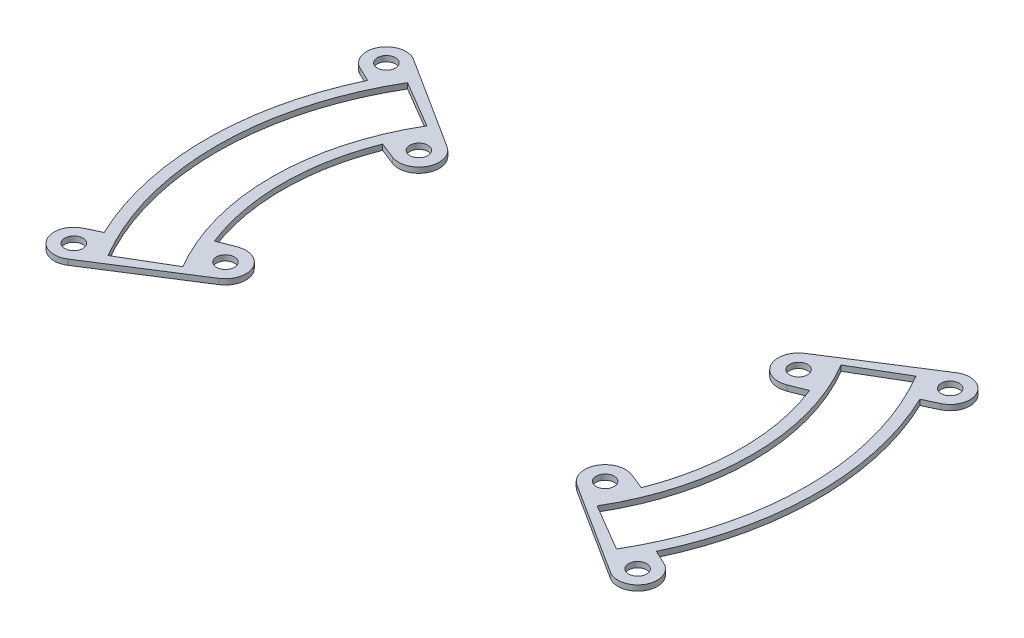
from build123d import *

# Parameters (mm, degrees)
SKETCH1_R           = 1.65
BOSS_EXTRUDE1_DEPTH = 1


with BuildPart() as part:
    # Sketch1 → Boss-Extrude1 (new body)
    with BuildSketch(Plane(origin=(0, 0, 0), x_dir=(1, 0, 0), z_dir=(0, 1, 0))):
        with BuildLine():
            Line((50.544775924, 24.108621421), (53.15320507, 25.352778303))
            ThreePointArc((53.15320507, 25.352778303), (54.752823812, 30.349985831), (49.667282695, 31.64154874))
            Line((49.667282695, 31.64154874), (32.740836917, 20.858213514))
            ThreePointArc((32.740836917, 20.858213514), (31.418686002, 16.008620108), (36.119230292, 14.227743183))
            Line((36.119230292, 14.227743183), (39.077537855, 15.393051522))
            ThreePointArc((39.077537855, 15.393051522), (42, 0), (39.077537855, -15.393051522))
            Line((39.077537855, -15.393051522), (36.119230292, -14.227743183))
            ThreePointArc((36.119230292, -14.227743183), (31.418686002, -16.008620108), (32.740836917, -20.858213514))
            Line((32.740836917, -20.858213514), (49.667282695, -31.64154874))
            ThreePointArc((49.667282695, -31.64154874), (54.752823812, -30.349985831), (53.15320507, -25.352778303))
            Line((53.15320507, -25.352778303), (50.544775924, -24.108621421))
            ThreePointArc((50.544775924, -24.108621421), (56, 0), (50.544775924, 24.108621421))
        make_face()
        with Locations((34.749254443, -17.70562949)):
            Circle(SKETCH1_R, mode=Mode.SUBTRACT)
        with Locations((51.602562721, -28.603767595)):
            Circle(SKETCH1_R, mode=Mode.SUBTRACT)
        with BuildLine():
            Line((46.527974664, -27.4070716), (37.911683059, -22.33168797))
            ThreePointArc((37.911683059, -22.33168797), (44, 0), (37.911683059, 22.33168797))
            Line((37.911683059, 22.33168797), (46.527974664, 27.4070716))
            ThreePointArc((46.527974664, 27.4070716), (54, 0), (46.527974664, -27.4070716))
        make_face(mode=Mode.SUBTRACT)
        with Locations((34.749254443, 17.70562949)):
            Circle(SKETCH1_R, mode=Mode.SUBTRACT)
        with Locations((51.602562721, 28.603767595)):
            Circle(SKETCH1_R, mode=Mode.SUBTRACT)
    extrude(amount=BOSS_EXTRUDE1_DEPTH)


with BuildPart() as body_2:
    # Mirror2: mirrored copy
    add(part.part.mirror(Plane(origin=(0, 0, 0), x_dir=(0, 0, 1), z_dir=(1, 0, 0))))


solid = Compound([part.part, body_2.part])
